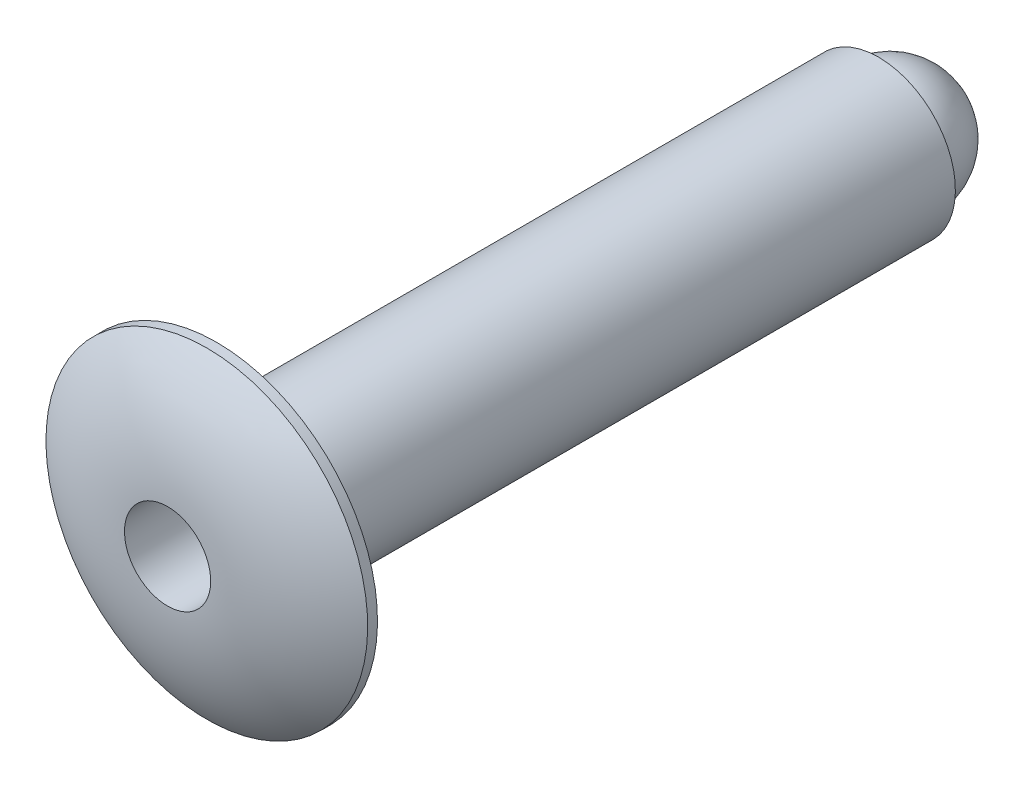
from build123d import *

# Parameters (mm, degrees)
FILLET2_R = 0.254


with BuildPart() as part:
    # Sketch2 → Revolve1 (revolve)
    with BuildSketch(Plane(origin=(0, 0, 0), x_dir=(0, 0, -1), z_dir=(1, 0, 0))):
        with BuildLine():
            Line((17.145, 1.984375), (0, 1.984375))
            Line((0, 1.984375), (0, 4.1656))
            Line((0, 4.1656), (-0.254, 4.1656))
            ThreePointArc((-0.254, 4.1656), (-1.009316934, 2.723306894), (-1.27, 1.116210937))
            Line((-1.27, 1.116210937), (0, 1.116210938))
            Line((0, 1.116210938), (1.7145, 1.116210938))
            Line((1.7145, 1.116210938), (1.7145, 0))
            Line((1.7145, 0), (17.145, 0))
            Line((17.145, 0), (17.145, 1.984375))
        make_face()
    revolve(axis=Axis((0, 0, -17.145), (0, 0, 1)))

    # Fillet2
    fillet2_edges = [part.edges().sort_by_distance(p)[0] for p in [
        (0, -1.984375, 0),
    ]]
    fillet(fillet2_edges, radius=FILLET2_R)


with BuildPart() as body_2:
    # Sketch8 → Revolve3 (revolve)
    with BuildSketch(Plane(origin=(0, 0, 0), x_dir=(0, 0, -1), z_dir=(1, 0, 0))):
        with BuildLine():
            Line((17.145, 1.5875), (17.145, 0))
            Line((17.145, 0), (19.05, 0))
            ThreePointArc((19.05, 0), (18.469272613, 1.239877136), (17.145, 1.5875))
        make_face()
    revolve(axis=Axis((0, 0, -17.145), (0, 0, -1)))


solid = Compound([part.part, body_2.part])
